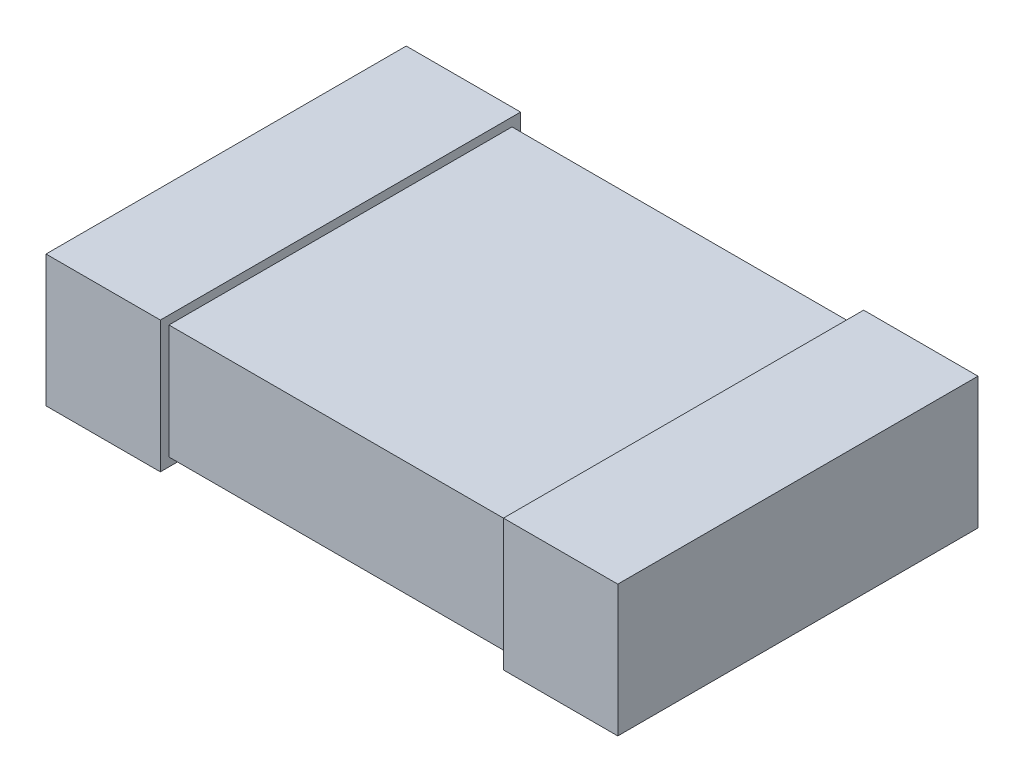
from build123d import *

# Parameters (mm, degrees)
SKETCH1_W           = 2
SKETCH1_H           = 1.2
EXTRUDE1_DEPTH      = 0.4
EXTRUDE2_DEPTH      = 0.63
EXTRUDE2_DEPTH_BACK = 0.63
SKETCH2_W           = 0.4
SKETCH2_H           = 0.46


with BuildPart() as part:
    # Sketch1 → Extrude1 (new body)
    with BuildSketch(Plane(origin=(0, 0, 0), x_dir=(1, 0, 0), z_dir=(0, 1, 0))):
        Rectangle(SKETCH1_W, SKETCH1_H)
    extrude(amount=EXTRUDE1_DEPTH)

    # Sketch2 → Extrude2 (add, two sides: drawn at the far end of the back side and taken through both)
    with BuildSketch(Plane.XY.offset(-EXTRUDE2_DEPTH_BACK)):
        with Locations((-0.8, 0.2)):
            Rectangle(SKETCH2_W, SKETCH2_H)
        with Locations((0.8, 0.2)):
            Rectangle(SKETCH2_W, SKETCH2_H)
    extrude(amount=EXTRUDE2_DEPTH + EXTRUDE2_DEPTH_BACK)


solid = part.part
